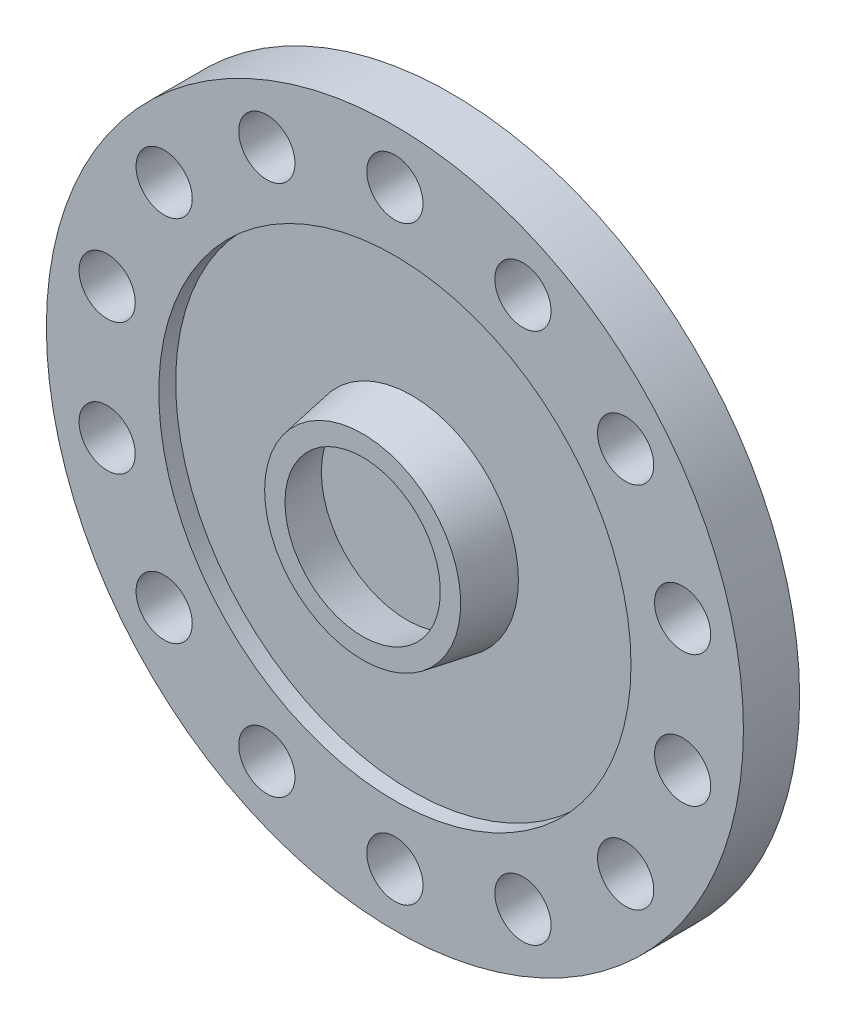
from build123d import *

# Parameters (mm, degrees)
SKETCH1_R           = 62
SKETCH1_R_2         = 5
SKETCH1_R_3         = 43
BOSS_EXTRUDE2_DEPTH = 10
SKETCH2_R           = 42
CUT_EXTRUDE1_DEPTH  = 3


with BuildPart() as part:
    # Sketch1 → Boss-Extrude2 (new body)
    # profile 1 of 2: a face of its own
    with BuildSketch(Plane.XY):
        Circle(SKETCH1_R)
        with Locations((-22.778896304, 47.300865565)):
            Circle(SKETCH1_R_2, mode=Mode.SUBTRACT)
        with Locations((-41.04615283, 32.733214598)):
            Circle(SKETCH1_R_2, mode=Mode.SUBTRACT)
        with Locations((-51.18371539, 11.682349033)):
            Circle(SKETCH1_R_2, mode=Mode.SUBTRACT)
        with Locations((-51.18371539, -11.682349033)):
            Circle(SKETCH1_R_2, mode=Mode.SUBTRACT)
        with Locations((-41.04615283, -32.733214598)):
            Circle(SKETCH1_R_2, mode=Mode.SUBTRACT)
        with Locations((-22.778896304, -47.300865565)):
            Circle(SKETCH1_R_2, mode=Mode.SUBTRACT)
        with Locations((0, -52.5)):
            Circle(SKETCH1_R_2, mode=Mode.SUBTRACT)
        with Locations((22.778896304, -47.300865565)):
            Circle(SKETCH1_R_2, mode=Mode.SUBTRACT)
        with Locations((41.04615283, -32.733214598)):
            Circle(SKETCH1_R_2, mode=Mode.SUBTRACT)
        with Locations((51.18371539, -11.682349033)):
            Circle(SKETCH1_R_2, mode=Mode.SUBTRACT)
        with Locations((51.18371539, 11.682349033)):
            Circle(SKETCH1_R_2, mode=Mode.SUBTRACT)
        with Locations((41.04615283, 32.733214598)):
            Circle(SKETCH1_R_2, mode=Mode.SUBTRACT)
        with Locations((22.778896304, 47.300865565)):
            Circle(SKETCH1_R_2, mode=Mode.SUBTRACT)
        with Locations((0, 52.5)):
            Circle(SKETCH1_R_2, mode=Mode.SUBTRACT)
        Circle(SKETCH1_R_3, mode=Mode.SUBTRACT)
    # profile 2 of 2: a face of its own
    with BuildSketch(Plane.XY):
        Circle(SKETCH1_R_3)
    extrude(amount=BOSS_EXTRUDE2_DEPTH)

    # Sketch2 → Cut-Extrude1 (cut)
    with BuildSketch(Plane.XY.offset(10)):
        Circle(SKETCH2_R)
    extrude(amount=-CUT_EXTRUDE1_DEPTH, mode=Mode.SUBTRACT)

    # Sketch5 → Revolve1 (revolve)
    with BuildSketch(Plane(origin=(0, 0, 0), x_dir=(1, 0, 0), z_dir=(0, 1, 0))):
        Polygon((0, -6.870835564), (-19, -6.870835564), (-17.437166401, -15.734105341), (-13.81978154, -15.734105341), (-15.206288158, -7.870835564), (0, -7.870835564), align=None)
    revolve(axis=Axis((0, 0, 0), (0, 0, 1)))


solid = part.part
